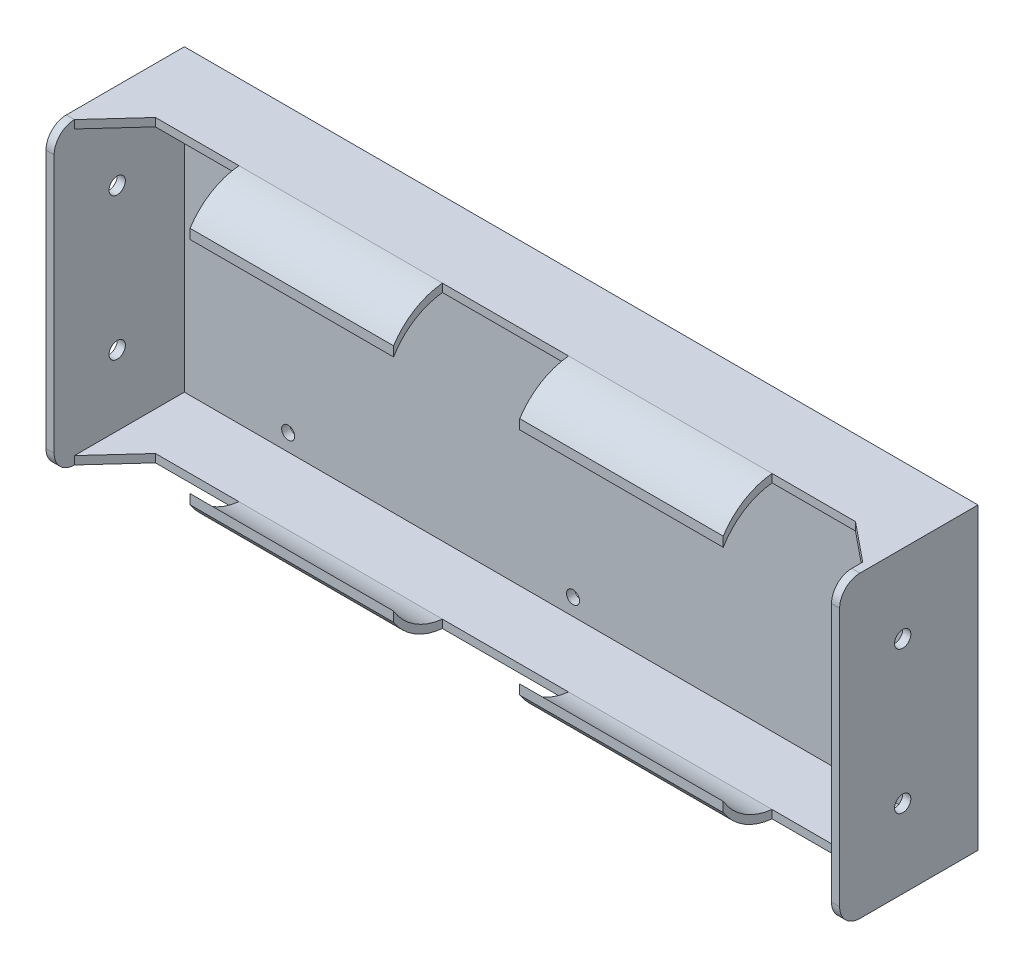
from build123d import *

# Parameters (mm, degrees)
SKETCH1_W            = 195
SKETCH1_H            = 73.5
SKETCH1_R            = 1.6
BOSS_EXTRUDE1_DEPTH  = 2
SKETCH2_W            = 2
SKETCH2_H            = 73.5
BOSS_EXTRUDE2_DEPTH  = 32
BOSS_EXTRUDE3_DEPTH  = 2
BOSS_EXTRUDE4_DEPTH  = 50
MIRROR3_COPY_1_DEPTH = 50
FILLET1_R            = 5
SKETCH6_R            = 1
BOSS_EXTRUDE5_DEPTH  = 15
SKETCH7_R            = 2
CUT_EXTRUDE1_DEPTH   = 212.147460321


with BuildPart() as part:
    # Sketch1 → Boss-Extrude1 (new body)
    with BuildSketch(Plane.XY):
        with Locations((97.5, 36.75)):
            Rectangle(SKETCH1_W, SKETCH1_H)
        with Locations((27.5, 67.364107359)):
            Circle(SKETCH1_R, mode=Mode.SUBTRACT)
        with Locations((97.5, 67.364107359)):
            Circle(SKETCH1_R, mode=Mode.SUBTRACT)
        with Locations((167.5, 67.364107359)):
            Circle(SKETCH1_R, mode=Mode.SUBTRACT)
        with Locations(Location((167.5, 6.135892641, 0), (0, 0, 180))):
            Circle(SKETCH1_R, mode=Mode.SUBTRACT)
        with Locations(Location((97.5, 6.135892641, 0), (0, 0, 180))):
            Circle(SKETCH1_R, mode=Mode.SUBTRACT)
        with Locations(Location((27.5, 6.135892641, 0), (0, 0, 180))):
            Circle(SKETCH1_R, mode=Mode.SUBTRACT)
    extrude(amount=BOSS_EXTRUDE1_DEPTH)

    # Sketch2 → Boss-Extrude2 (add)
    with BuildSketch(Plane.XY.offset(2)):
        with Locations((1, 36.75)):
            Rectangle(SKETCH2_W, SKETCH2_H)
        with Locations((194, 36.75)):
            Rectangle(SKETCH2_W, SKETCH2_H)
    extrude(amount=BOSS_EXTRUDE2_DEPTH)

    # Sketch3 → Boss-Extrude3 (add)
    with BuildSketch(Plane.XZ):
        Polygon((0, 0), (0, 29), (2, 29), (11.5, 18.6), (183.5, 18.6), (193, 26.325039357), (195, 26.325039357), (195, 0), align=None)
    boss_extrude3 = extrude(amount=-BOSS_EXTRUDE3_DEPTH)

    # Mirror1: Boss-Extrude3 across plane
    add(boss_extrude3.mirror(Plane(origin=(0, 36.75, 0), x_dir=(0, 0, 1), z_dir=(0, -1, 0))))

    # 3DSketch1 → Boss-Extrude4 (add)
    with BuildSketch(Plane(origin=(32, 0, 18.6), x_dir=(0, 0.995265198446773, -0.09719662936905633), z_dir=(1, 0, 0))):
        with BuildLine():
            Line((0, 0), (1.990530397, 0.194393259))
            ThreePointArc((1.990530397, 0.194393259), (3.755453085, 7.307606505), (8.506639352, 12.887838028))
            Line((8.506639352, 12.887838028), (6.133305317, 12.656060539))
            ThreePointArc((6.133305317, 12.656060539), (1.603781504, 7.03695825), (0, 0))
        make_face()
    boss_extrude4 = extrude(amount=BOSS_EXTRUDE4_DEPTH)

    # Mirror2: Boss-Extrude4 across plane
    add(boss_extrude4.mirror(Plane(origin=(97.5, 0, 0), x_dir=(0, 0, 1), z_dir=(1, 0, 0))))

    # Mirror3: Boss-Extrude4 across plane
    add(boss_extrude4.mirror(Plane(origin=(0, 36.75, 0), x_dir=(0, 0, 1), z_dir=(0, -1, 0))))

    # Mirror3 copy 1 sketch → Mirror3 copy 1 (add)
    with BuildSketch(Plane(origin=(163, 73.5, 18.6), x_dir=(0, -0.995265198446773, -0.09719662936905633), z_dir=(-1, 0, 0))):
        with BuildLine():
            Line((0, 0), (1.990530397, 0.194393259))
            ThreePointArc((1.990530397, 0.194393259), (3.755453085, 7.307606505), (8.506639352, 12.887838028))
            Line((8.506639352, 12.887838028), (6.133305317, 12.656060539))
            ThreePointArc((6.133305317, 12.656060539), (1.603781504, 7.03695825), (0, 0))
        make_face()
    extrude(amount=MIRROR3_COPY_1_DEPTH)

    # Fillet1
    fillet1_edges = [part.edges().sort_by_distance(p)[0] for p in [
        (1, 0, 34),
        (1, 73.5, 34),
        (194, 73.5, 34),
        (194, 0, 34),
    ]]
    fillet(fillet1_edges, radius=FILLET1_R)

    # Sketch6 → Boss-Extrude5 (add)
    with BuildSketch(Plane.ZY):
        with Locations(Location((5, 46.75, 0), (0, 0, 180))):
            Circle(SKETCH6_R)
        with Locations(Location((5, 26.75, 0), (0, 0, 180))):
            Circle(SKETCH6_R)
    extrude(amount=BOSS_EXTRUDE5_DEPTH)

    # Sketch7 → Cut-Extrude1 (cut, through all)
    with BuildSketch(Plane.ZY):
        with Locations((18.5, 54.25)):
            Circle(SKETCH7_R)
        with Locations((18.5, 19.25)):
            Circle(SKETCH7_R)
    extrude(amount=-CUT_EXTRUDE1_DEPTH, mode=Mode.SUBTRACT)


solid = part.part
